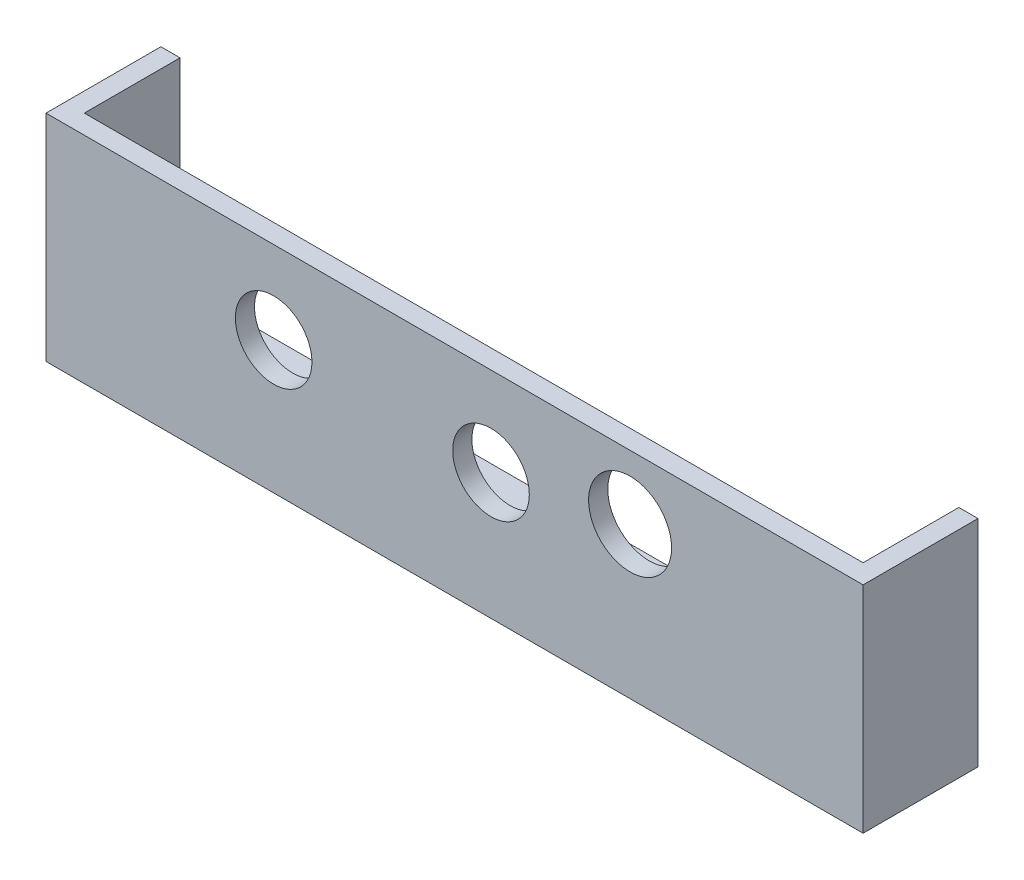
from build123d import *

# Parameters (mm, degrees)
SKETCH_1_W      = 128
SKETCH_1_H      = 33.7
SKETCH_1_R      = 6.5
SKETCH_1_R_2    = 6
EXTRUDE_1_DEPTH = 3
EXTRUDE_2_DEPTH = 15


with BuildPart() as part:
    # 草圖1 → 填料-伸長1 (new body)
    with BuildSketch(Plane.XY):
        with Locations((-30.980810071, -55.280072207)):
            Rectangle(SKETCH_1_W, SKETCH_1_H)
        with Locations((-3.480809972, -48.430072207)):
            Circle(SKETCH_1_R, mode=Mode.SUBTRACT)
        with Locations((-25.269668394, -52.330072207)):
            Circle(SKETCH_1_R_2, mode=Mode.SUBTRACT)
        with Locations((-59.319668394, -51.380072207)):
            Circle(SKETCH_1_R_2, mode=Mode.SUBTRACT)
    extrude(amount=EXTRUDE_1_DEPTH)

    # 草圖2 → 填料-伸長2 (add)
    with BuildSketch(Plane(origin=(0, 0, 0), x_dir=(-1, 0, 0), z_dir=(0, 0, -1))):
        Polygon((91.980810071, -38.430072207), (91.980810071, -69.130072207), (-30.019189929, -69.130072207), (-30.019189929, -38.430072207), (-33.019189929, -38.430072207), (-33.019189929, -72.130072207), (94.980810071, -72.130072207), (94.980810071, -38.430072207), align=None)
    extrude(amount=EXTRUDE_2_DEPTH)


solid = part.part
